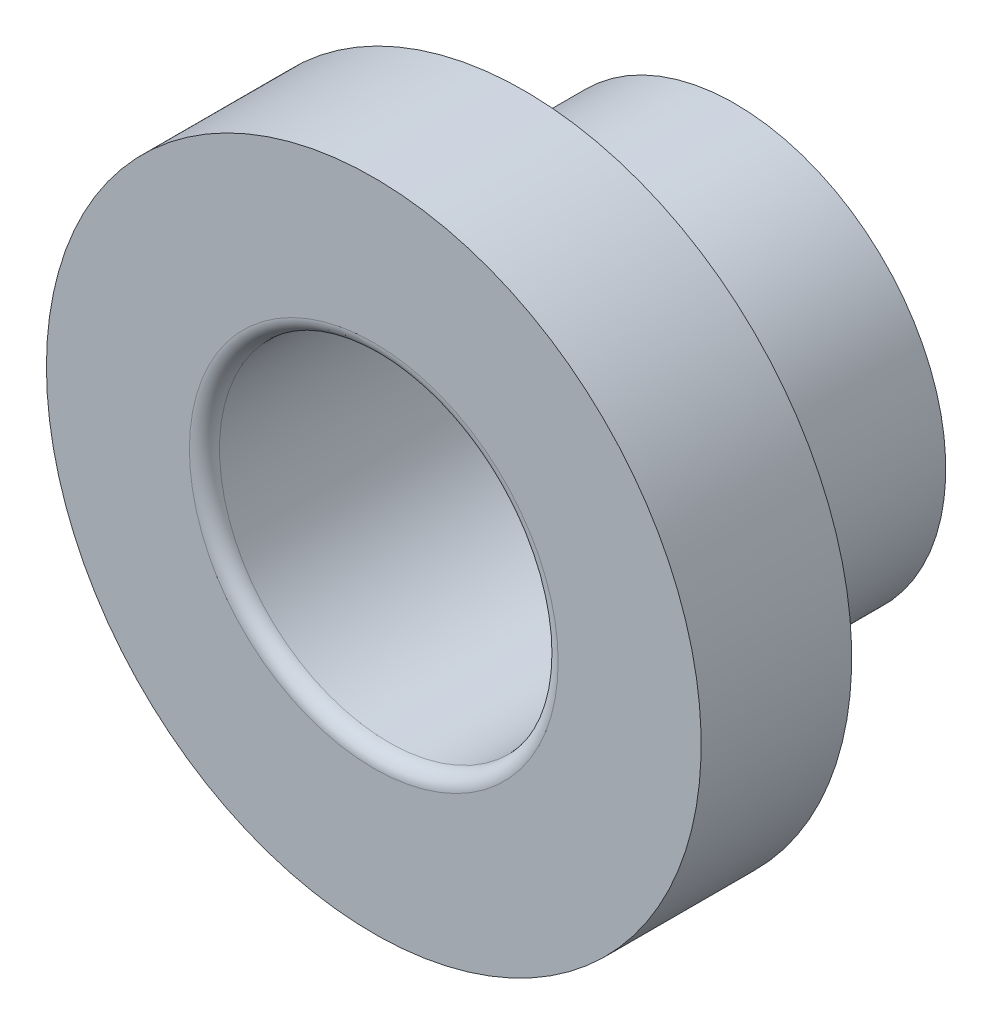
from build123d import *

# Parameters (mm, degrees)
HOLEWZD1_D = 2.25
FILLET1_R  = 0.1


with BuildPart() as part:
    # Sketch1 → Revolve1 (revolve)
    with BuildSketch(Plane.XZ, mode=Mode.PRIVATE) as revolve1_sk:
        Polygon((0, 0), (1.4, 0), (1.4, 1.4), (2.175, 1.4), (2.175, 2.4), (0, 2.4), align=None)
    revolve(revolve1_sk.sketch.rotate(Axis((0, 0, 2.4), (0, 0, -1)), 180), axis=Axis((0, 0, 2.4), (0, 0, -1)))

    # HoleWzd1 (through all)
    with Locations(Plane.XY.offset(2.4)):
        with Locations((0, 0)):
            Hole(HOLEWZD1_D / 2)

    # Fillet1
    fillet1_edges = [part.edges().sort_by_distance(p)[0] for p in [
        (1.125, 0, 2.4),
    ]]
    fillet(fillet1_edges, radius=FILLET1_R)


solid = part.part
